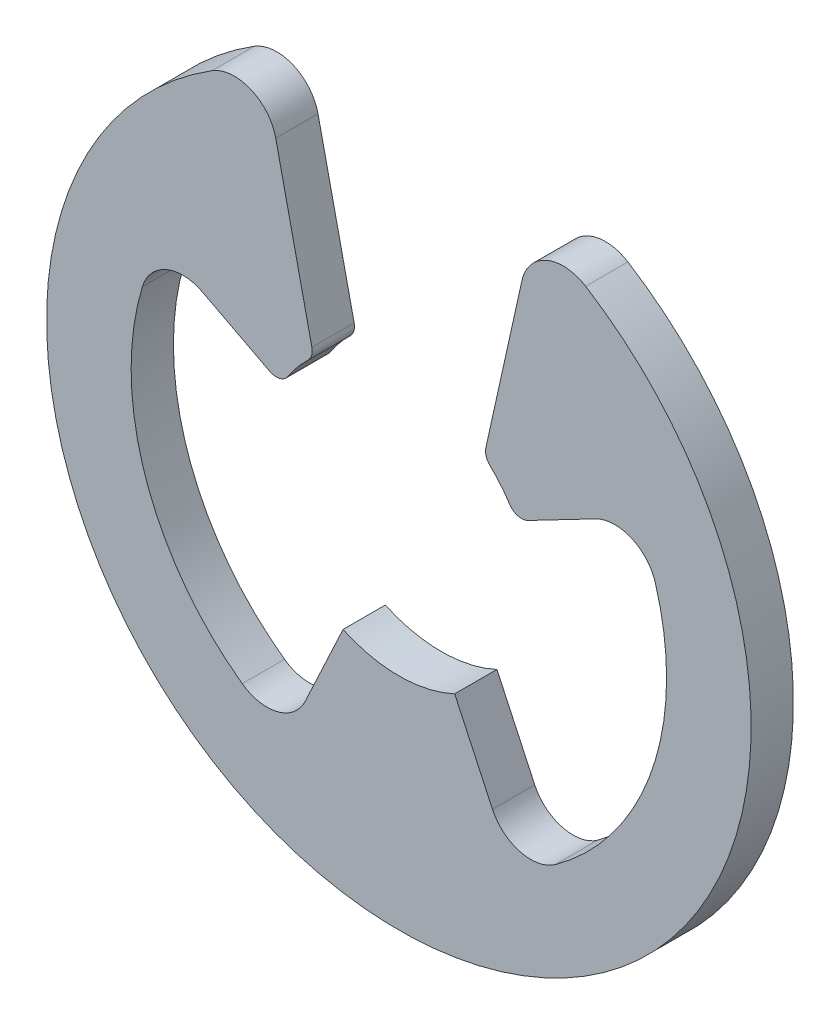
from build123d import *
from OCP.BRepFilletAPI import BRepFilletAPI_MakeFillet

# Parameters (mm, degrees)
SKETCH1_R           = 3.175
SKETCH1_R_2         = 1.190625
BOSS_EXTRUDE1_DEPTH = 0.1905
CUT_EXTRUDE1_DEPTH  = 5.50626353
CUT_EXTRUDE2_DEPTH  = 5.50626353
FILLET1_R1          = 0.381
FILLET1_R2          = 0.127


with BuildPart() as part:
    # Sketch1 → Boss-Extrude1 (new, symmetric)
    with BuildSketch(Plane.XY):
        Circle(SKETCH1_R)
        Circle(SKETCH1_R_2, mode=Mode.SUBTRACT)
    extrude(amount=BOSS_EXTRUDE1_DEPTH, both=True)

    # Sketch2 → Cut-Extrude1 (cut, through all)
    with BuildSketch(Plane.XY.offset(0.1905)):
        Polygon((-0.635, 0.3107001), (0.635, 0.3107001), (1.27, 3.175), (-1.27, 3.175), align=None)
    extrude(amount=-CUT_EXTRUDE1_DEPTH, mode=Mode.SUBTRACT)

    # Sketch3 → Cut-Extrude2 (cut, through all)
    with BuildSketch(Plane.XY.offset(0.1905)):
        with BuildLine():
            Line((-1.05664, 0.548725615), (-2.140900128, 1.113155712))
            ThreePointArc((-2.140900128, 1.113155712), (-2.284707131, -0.776326171), (-1.019518005, -2.187041846))
            Line((-1.019518005, -2.187041846), (-0.50292, -1.079193849))
            ThreePointArc((-0.50292, -1.079193849), (-1.127203307, -0.383406568), (-1.05664, 0.548725615))
        make_face()
        with BuildLine():
            Line((0.50292, -1.079193849), (1.019518005, -2.187041846))
            ThreePointArc((1.019518005, -2.187041846), (2.284707131, -0.776326171), (2.140900128, 1.113155712))
            Line((2.140900128, 1.113155712), (1.05664, 0.548725615))
            ThreePointArc((1.05664, 0.548725615), (1.127203307, -0.383406568), (0.50292, -1.079193849))
        make_face()
    extrude(amount=-CUT_EXTRUDE2_DEPTH, mode=Mode.SUBTRACT)

    # Fillet1: one fillet with a radius per group of edges: ONE call of the kernel's fillet builder (fillet() takes one radius for all edges)
    fillet1_edges_1 = [part.edges().sort_by_distance(p)[0] for p in [
        (-1.216302436, 2.932785942, 0),
        (-2.140900128, 1.113155712, 0),
        (-1.019518005, -2.187041846, 0),
        (1.019518005, -2.187041846, 0),
        (2.140900128, 1.113155712, 0),
        (1.216302436, 2.932785942, 0),
    ]]
    fillet1_edges_2 = [part.edges().sort_by_distance(p)[0] for p in [
        (-0.767848913, 0.909942821, 0),
        (-1.05664, 0.548725615, 0),
        (0.767848913, 0.909942821, 0),
        (1.05664, 0.548725615, 0),
    ]]
    fillet1 = BRepFilletAPI_MakeFillet(part.part.solid().wrapped)
    for e in fillet1_edges_1:
        fillet1.Add(FILLET1_R1, e.wrapped)
    for e in fillet1_edges_2:
        fillet1.Add(FILLET1_R2, e.wrapped)
    add(Compound.cast(fillet1.Shape()), mode=Mode.REPLACE)


solid = part.part
